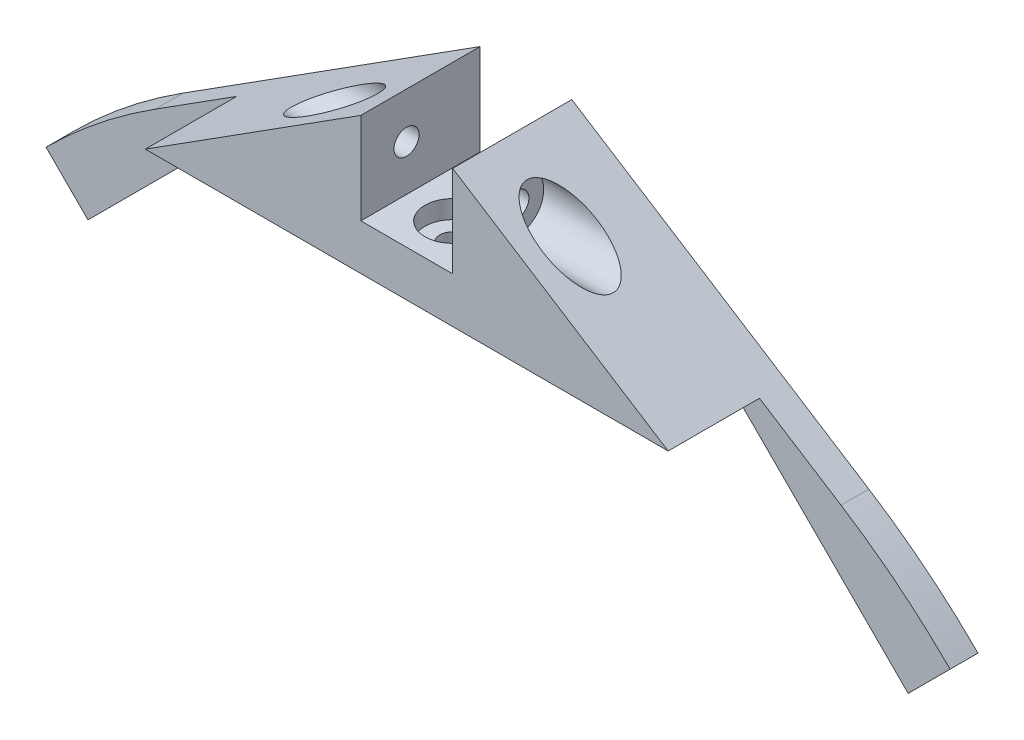
from build123d import *

# Parameters (mm, degrees)
BOSS_EXTRUDE4_DEPTH     = 6.1
BOSS_EXTRUDE5_DEPTH     = 20
BOSS_EXTRUDE6_DEPTH     = 6.1
BOSS_EXTRUDE7_DEPTH     = 20
CUT_EXTRUDE1_DEPTH      = 189.786254796
CUT_EXTRUDE1_DEPTH_BACK = 189.786254796
SKETCH9_W               = 20.1
SKETCH9_H               = 10
SKETCH10_R              = 2.75
CUT_EXTRUDE2_DEPTH      = 20
SKETCH11_R              = 6
CUT_EXTRUDE3_DEPTH      = 4
CUT_EXTRUDE4_DEPTH      = 189.786254796
CUT_EXTRUDE4_DEPTH_BACK = 189.786254796
SKETCH12_R              = 2.75
SKETCH13_R              = 6
CUT_EXTRUDE5_DEPTH      = 197.489461759
SKETCH14_R              = 6
CUT_EXTRUDE6_DEPTH      = 197.489461759


with BuildPart() as part:
    # Sketch5 → Boss-Extrude4 (new body)
    with BuildSketch(Plane.XY):
        with BuildLine():
            Line((-89.802561211, 89.802561211), (-50.105122421, 129.5))
            Line((-50.105122421, 129.5), (50.105122421, 129.5))
            Line((50.105122421, 129.5), (89.802561211, 89.802561211))
            Line((89.802561211, 89.802561211), (98.994949366, 98.994949366))
            ThreePointArc((98.994949366, 98.994949366), (0, 140), (-98.994949366, 98.994949366))
            Line((-98.994949366, 98.994949366), (-89.802561211, 89.802561211))
        make_face()
    extrude(amount=-BOSS_EXTRUDE4_DEPTH)

    # Sketch6 → Boss-Extrude5 (add)
    with BuildSketch(Plane.XY):
        Polygon((10.05, 139.5), (-10.05, 139.5), (-10.05, 159.5), (-50.105122421, 130.726725298), (-50.105122421, 129.5), (50.105122421, 129.5), (50.105122421, 130.726725298), (10.05, 159.5), align=None)
    extrude(amount=BOSS_EXTRUDE5_DEPTH)

    # Sketch7 → Boss-Extrude6 (add)
    with BuildSketch(Plane.XY):
        with BuildLine():
            Line((-10.05, 159.5), (-75.100690367, 118.15196277))
            ThreePointArc((-75.100690367, 118.15196277), (-87.573230694, 109.228793209), (-98.994949366, 98.994949366))
            Line((-98.994949366, 98.994949366), (-89.802561211, 89.802561211))
            Line((-89.802561211, 89.802561211), (-50.105122421, 129.5))
            Line((-50.105122421, 129.5), (50.105122421, 129.5))
            Line((50.105122421, 129.5), (89.802561211, 89.802561211))
            Line((89.802561211, 89.802561211), (98.994949366, 98.994949366))
            ThreePointArc((98.994949366, 98.994949366), (87.573230694, 109.228793209), (75.100690367, 118.15196277))
            Line((75.100690367, 118.15196277), (10.05, 159.5))
            Line((10.05, 159.5), (10.05, 139.5))
            Line((10.05, 139.5), (-10.05, 139.5))
            Line((-10.05, 139.5), (-10.05, 159.5))
        make_face()
    extrude(amount=-BOSS_EXTRUDE6_DEPTH)

    # Sketch8 → Boss-Extrude7 (add)
    with BuildSketch(Plane.XY):
        Polygon((-50.105122421, 130.726725298), (-50.105122421, 129.5), (-57.247420766, 129.5), (-10.05, 159.5), align=None)
        Polygon((50.105122421, 129.5), (57.247420766, 129.5), (10.05, 159.5), (50.105122421, 130.726725298), align=None)
    extrude(amount=BOSS_EXTRUDE7_DEPTH)

    # Sketch9 → Cut-Extrude1 (cut, two sides: drawn at the far end of the back side and taken through both)
    with BuildSketch(Plane.XY.offset(-CUT_EXTRUDE1_DEPTH_BACK)):
        with Locations((0, 144.5)):
            Rectangle(SKETCH9_W, SKETCH9_H)
    extrude(amount=CUT_EXTRUDE1_DEPTH + CUT_EXTRUDE1_DEPTH_BACK, mode=Mode.SUBTRACT)

    # Sketch10 → Cut-Extrude2 (cut)
    with BuildSketch(Plane(origin=(0, 139.5, 0), x_dir=(1, 0, 0), z_dir=(0, 1, 0))):
        with Locations(Location((0, -10, 0), (0, 0, 180))):
            Circle(SKETCH10_R)
    extrude(amount=-CUT_EXTRUDE2_DEPTH, mode=Mode.SUBTRACT)

    # Sketch11 → Cut-Extrude3 (cut)
    with BuildSketch(Plane(origin=(0, 139.5, 0), x_dir=(1, 0, 0), z_dir=(0, 1, 0))):
        with Locations(Location((0, -10, 0), (0, 0, 180))):
            Circle(SKETCH11_R)
    extrude(amount=-CUT_EXTRUDE3_DEPTH, mode=Mode.SUBTRACT)

    # Sketch12 → Cut-Extrude4 (cut, two sides: drawn at the far end of the back side and taken through both)
    with BuildSketch(Plane(origin=(0, 0, 0), x_dir=(0, 0, -1), z_dir=(1, 0, 0)).offset(-CUT_EXTRUDE4_DEPTH_BACK)):
        with Locations(Location((-10, 149.5, 0), (0, 0, 270))):
            Circle(SKETCH12_R)
    extrude(amount=CUT_EXTRUDE4_DEPTH + CUT_EXTRUDE4_DEPTH_BACK, mode=Mode.SUBTRACT)

    # Sketch13 → Cut-Extrude5 (cut, through all)
    with BuildSketch(Plane(origin=(14, 0, 0), x_dir=(0, 0, -1), z_dir=(1, 0, 0))):
        with Locations(Location((-10, 149.5, 0), (0, 0, 90))):
            Circle(SKETCH13_R)
    extrude(amount=CUT_EXTRUDE5_DEPTH, mode=Mode.SUBTRACT)

    # Sketch14 → Cut-Extrude6 (cut, through all)
    with BuildSketch(Plane(origin=(-14, 0, 0), x_dir=(0, 0, -1), z_dir=(1, 0, 0))):
        with Locations(Location((-10, 149.5, 0), (0, 0, 90))):
            Circle(SKETCH14_R)
    extrude(amount=-CUT_EXTRUDE6_DEPTH, mode=Mode.SUBTRACT)


solid = part.part
